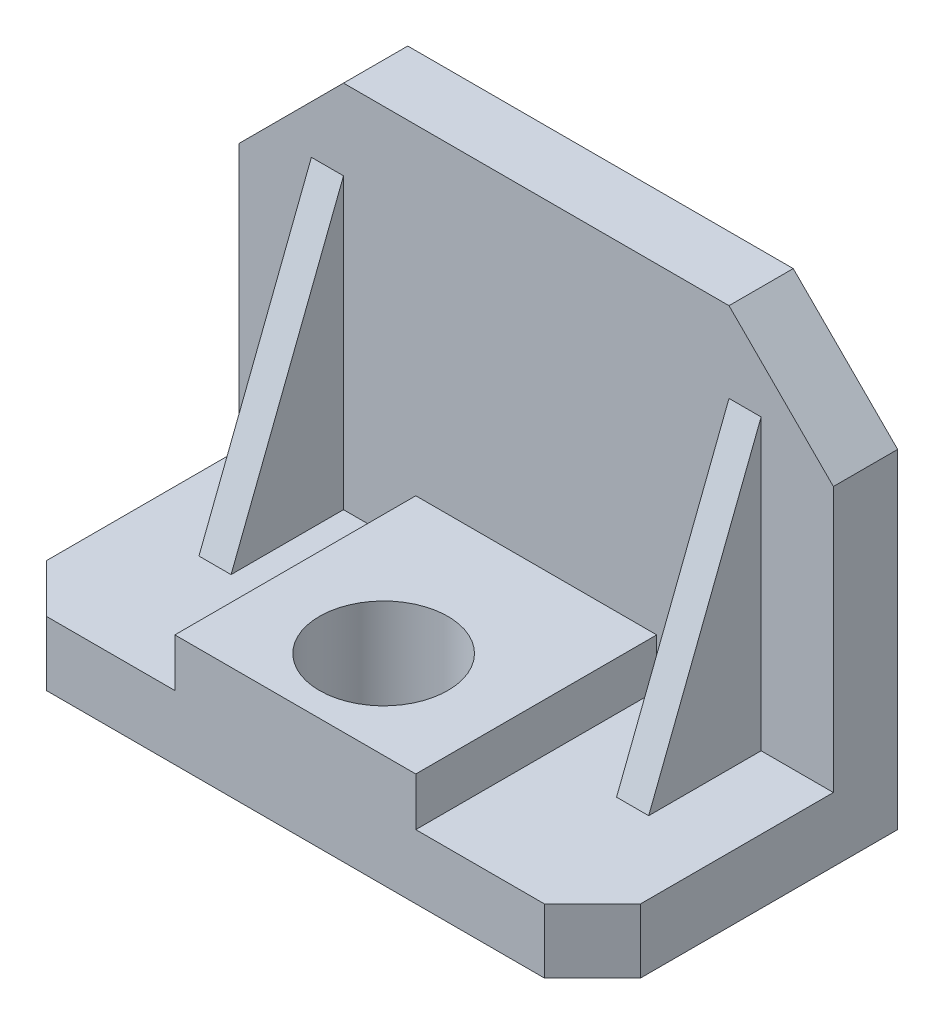
from build123d import *

# Parameters (mm, degrees)
BOSS_EXTRUDE4_DEPTH  = 4
SKETCH5_W            = 74
SKETCH5_H            = 8
BOSS_EXTRUDE5_DEPTH  = 30
SKETCH6_W            = 4
SKETCH6_H            = 36
BOSS_EXTRUDE6_DEPTH  = 18
CUT_EXTRUDE2_DEPTH   = 18
SKETCH9_W            = 30
SKETCH9_H            = 30
BOSS_EXTRUDE11_DEPTH = 6
SKETCH10_R           = 8
CUT_EXTRUDE3_DEPTH   = 50
CUT_EXTRUDE4_DEPTH   = 8
CUT_EXTRUDE5_DEPTH   = 8


with BuildPart() as part:
    # Sketch1 → Boss-Extrude4 (new, symmetric)
    with BuildSketch(Plane.XY):
        Polygon((-74, 0), (-74, 41), (-61, 54), (-13, 54), (0, 41), (0, 0), align=None)
    extrude(amount=BOSS_EXTRUDE4_DEPTH, both=True)

    # Sketch5 → Boss-Extrude5 (add)
    with BuildSketch(Plane.XY.offset(4)):
        with Locations((-37, 4)):
            Rectangle(SKETCH5_W, SKETCH5_H)
    extrude(amount=BOSS_EXTRUDE5_DEPTH)

    # Sketch6 → Boss-Extrude6 (add)
    with BuildSketch(Plane.XY):
        with Locations((-63, 26)):
            Rectangle(SKETCH6_W, SKETCH6_H)
        with Locations((-11, 26)):
            Rectangle(SKETCH6_W, SKETCH6_H)
    extrude(amount=BOSS_EXTRUDE6_DEPTH)

    # Sketch8 → Cut-Extrude2 (cut)
    with BuildSketch(Plane(origin=(0, 8, 0), x_dir=(1, 0, 0), z_dir=(0, 1, 0))):
        Polygon((-74, -28), (-67.996452301, -34), (-74, -34), align=None)
        Polygon((0, -34), (-6, -34), (0, -28), align=None)
    extrude(amount=-CUT_EXTRUDE2_DEPTH, mode=Mode.SUBTRACT)

    # Sketch9 → Boss-Extrude11 (add)
    with BuildSketch(Plane(origin=(0, 8, 0), x_dir=(1, 0, 0), z_dir=(0, 1, 0))):
        with Locations((-37, -19)):
            Rectangle(SKETCH9_W, SKETCH9_H)
    extrude(amount=BOSS_EXTRUDE11_DEPTH)

    # Sketch10 → Cut-Extrude3 (cut)
    with BuildSketch(Plane(origin=(0, 14, 0), x_dir=(1, 0, 0), z_dir=(0, 1, 0))):
        with Locations(Location((-37, -23, 0), (0, 0, 270))):
            Circle(SKETCH10_R)
    extrude(amount=-CUT_EXTRUDE3_DEPTH, mode=Mode.SUBTRACT)

    # Sketch11 → Cut-Extrude4 (cut)
    with BuildSketch(Plane(origin=(-9, 0, 0), x_dir=(0, 0, -1), z_dir=(1, 0, 0))):
        Polygon((-4, 44), (-18, 8), (-18, 44), align=None)
    extrude(amount=-CUT_EXTRUDE4_DEPTH, mode=Mode.SUBTRACT)

    # Sketch12 → Cut-Extrude5 (cut)
    with BuildSketch(Plane(origin=(-61, 0, 0), x_dir=(0, 0, -1), z_dir=(1, 0, 0))):
        Polygon((-4, 44), (-18, 8), (-18, 44), align=None)
    extrude(amount=-CUT_EXTRUDE5_DEPTH, mode=Mode.SUBTRACT)


solid = part.part
